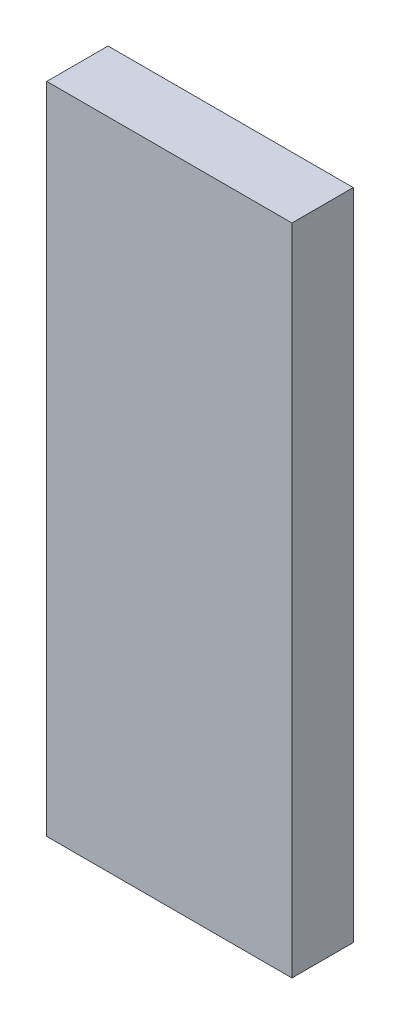
from build123d import *

# Parameters (mm, degrees)
SKETCH1_W           = 12
SKETCH1_H           = 32
BOSS_EXTRUDE1_DEPTH = 3


with BuildPart() as part:
    # Sketch1 → Boss-Extrude1 (new body)
    with BuildSketch(Plane.XY):
        with Locations((68.585871194, -180)):
            Rectangle(SKETCH1_W, SKETCH1_H)
    extrude(amount=BOSS_EXTRUDE1_DEPTH)


solid = part.part
